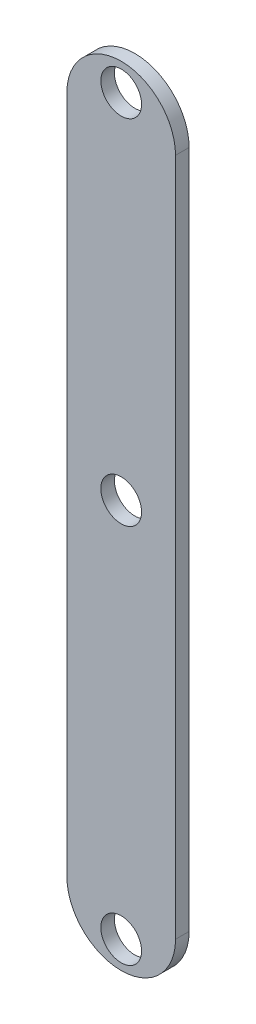
from build123d import *

# Parameters (mm, degrees)
BOSS_EXTRUDE1_DEPTH     = 5
CUT_EXTRUDE4_DEPTH      = 271.785893281
CUT_EXTRUDE4_DEPTH_BACK = 271.785893281
SKETCH3_R               = 7.5
CUT_EXTRUDE5_DEPTH      = 271.785893281
CUT_EXTRUDE5_DEPTH_BACK = 271.785893281
SKETCH5_R               = 7.5


with BuildPart() as part:
    # Sketch1 → Boss-Extrude1 (new body)
    with BuildSketch(Plane.XY):
        with BuildLine():
            Line((-20, 0), (-20, 250))
            ThreePointArc((-20, 250), (0, 270), (20, 250))
            Line((20, 250), (20, 0))
            ThreePointArc((20, 0), (0, -20), (-20, 0))
        make_face()
    extrude(amount=BOSS_EXTRUDE1_DEPTH)

    # Sketch3 → Cut-Extrude4 (cut, two sides: drawn at the far end of the back side and taken through both)
    with BuildSketch(Plane.XY.offset(-CUT_EXTRUDE4_DEPTH_BACK)):
        with Locations((0, 260)):
            Circle(SKETCH3_R)
        with Locations((0, -10)):
            Circle(SKETCH3_R)
    extrude(amount=CUT_EXTRUDE4_DEPTH + CUT_EXTRUDE4_DEPTH_BACK, mode=Mode.SUBTRACT)

    # Sketch5 → Cut-Extrude5 (cut, two sides: drawn at the far end of the back side and taken through both)
    with BuildSketch(Plane.XY.offset(5).offset(-CUT_EXTRUDE5_DEPTH_BACK)):
        with Locations((0, 129.974184192)):
            Circle(SKETCH5_R)
    extrude(amount=CUT_EXTRUDE5_DEPTH + CUT_EXTRUDE5_DEPTH_BACK, mode=Mode.SUBTRACT)


solid = part.part
